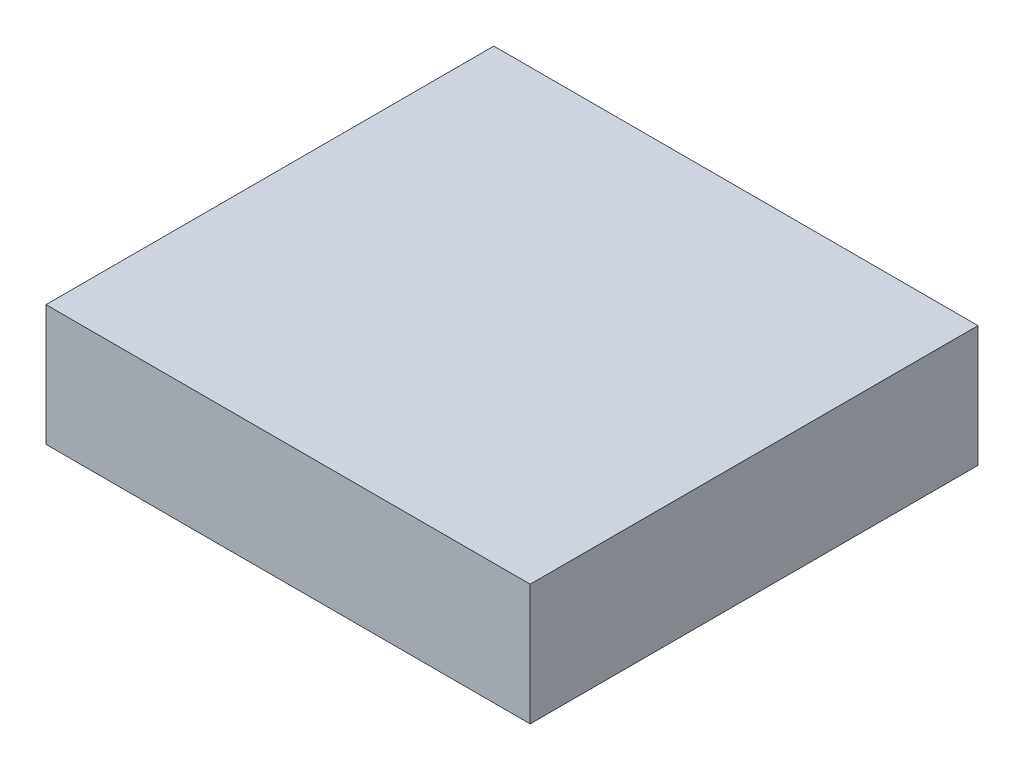
from build123d import *

# Parameters (mm, degrees)
SKETCH1_W           = 40
SKETCH1_H           = 37
BOSS_EXTRUDE1_DEPTH = 10


with BuildPart() as part:
    # Sketch1 → Boss-Extrude1 (new body)
    with BuildSketch(Plane(origin=(0, 0, 0), x_dir=(1, 0, 0), z_dir=(0, 1, 0))):
        with Locations((20, 18.5)):
            Rectangle(SKETCH1_W, SKETCH1_H)
    extrude(amount=-BOSS_EXTRUDE1_DEPTH)


solid = part.part
